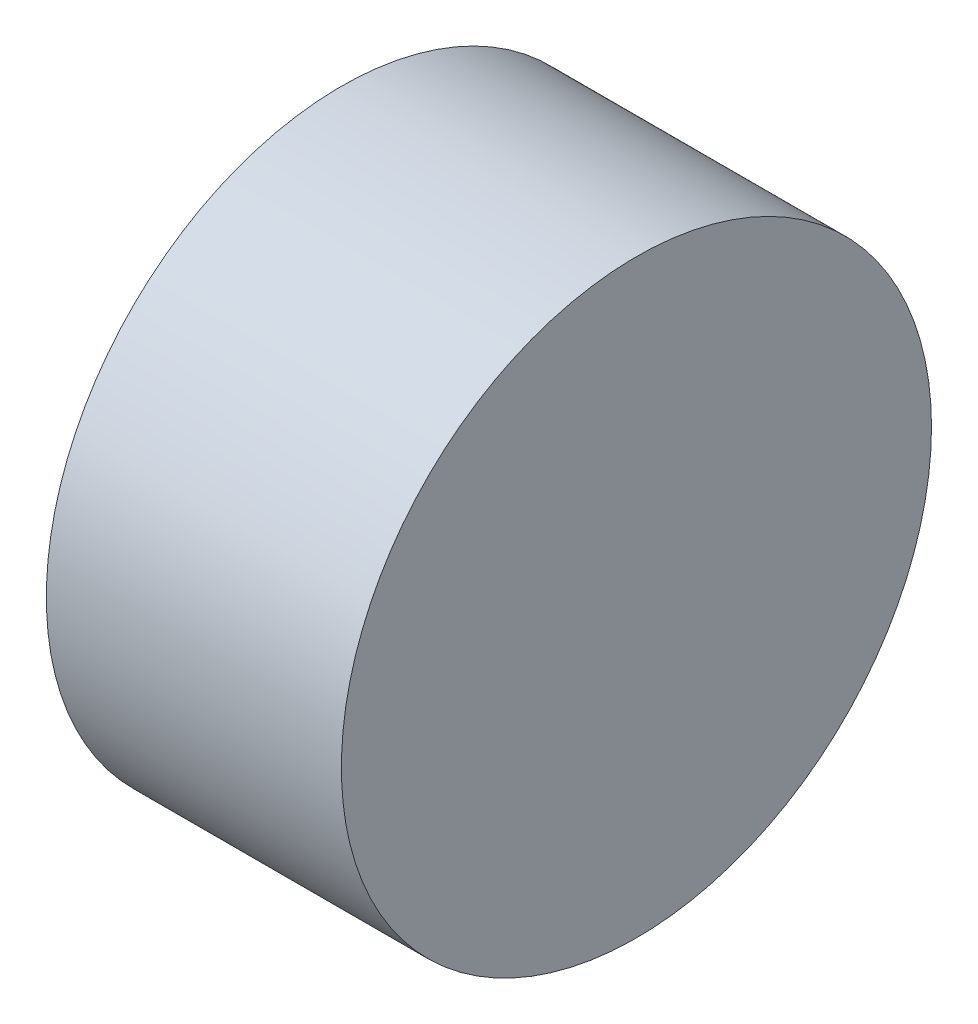
from build123d import *

# Parameters (mm, degrees)
SKETCH1_R           = 50.8
BOSS_EXTRUDE1_DEPTH = 25.4


with BuildPart() as part:
    # Sketch1 → Boss-Extrude1 (new, symmetric)
    with BuildSketch(Plane(origin=(0, 0, 0), x_dir=(0, 0, -1), z_dir=(1, 0, 0))):
        Circle(SKETCH1_R)
    extrude(amount=BOSS_EXTRUDE1_DEPTH, both=True)


solid = part.part
